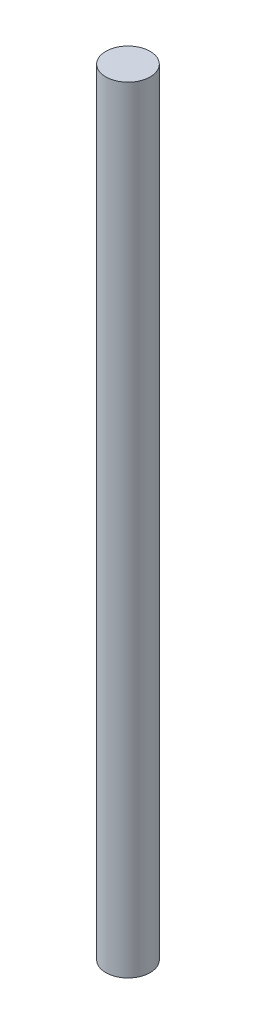
from build123d import *

# Parameters (mm, degrees)
SKETCH_1_R      = 1
EXTRUDE_1_DEPTH = 35


with BuildPart() as part:
    # 草图1 → 凸台-拉伸1 (new body)
    with BuildSketch(Plane(origin=(0, 0, 0), x_dir=(1, 0, 0), z_dir=(0, 1, 0))):
        with Locations(Location((0, 0, 0), (0, 0, 270))):
            Circle(SKETCH_1_R)
    extrude(amount=EXTRUDE_1_DEPTH)


solid = part.part
